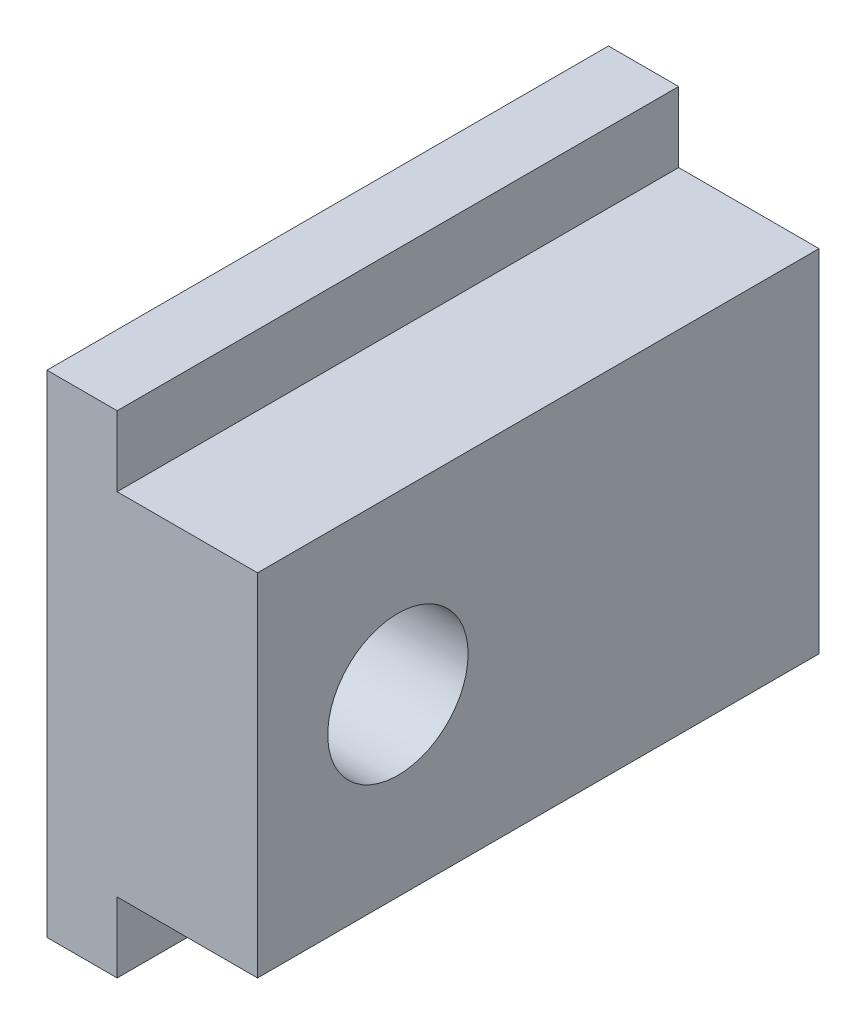
from build123d import *

# Parameters (mm, degrees)
BOSS_EXTRUDE1_DEPTH             = 25.4
SKETCH3_R                       = 3.175
CUT_EXTRUDE1_DEPTH              = 36.06902123
F_1_4_0_25_DIAMETER_HOLE1_D     = 6.35
F_1_4_0_25_DIAMETER_HOLE1_DEPTH = 12.7
F_1_4_0_25_DIAMETER_HOLE1_TIP   = 1.907732465


with BuildPart() as part:
    # Sketch1 → Boss-Extrude1 (new body)
    with BuildSketch(Plane.XY):
        Polygon((0, 0), (3.175, 0), (3.175, 3.175), (9.525, 3.175), (9.525, 19.05), (3.175, 19.05), (3.175, 22.225), (0, 22.225), align=None)
    extrude(amount=BOSS_EXTRUDE1_DEPTH)

    # Sketch3 → Cut-Extrude1 (cut, through all)
    with BuildSketch(Plane(origin=(9.525, 0, 0), x_dir=(0, 0, -1), z_dir=(1, 0, 0))):
        with Locations((-19.05, 11.1125)):
            Circle(SKETCH3_R)
    extrude(amount=-CUT_EXTRUDE1_DEPTH, mode=Mode.SUBTRACT)

    # 1/4 (0.25) Diameter Hole1
    with Locations(Plane(origin=(0, 0, 0), x_dir=(-1, 0, 0), z_dir=(0, 0, -1))):
        with Locations((-4.7625, 11.1125)):
            Hole(F_1_4_0_25_DIAMETER_HOLE1_D / 2, depth=F_1_4_0_25_DIAMETER_HOLE1_DEPTH)
            with Locations((0, 0, -(F_1_4_0_25_DIAMETER_HOLE1_DEPTH + F_1_4_0_25_DIAMETER_HOLE1_TIP / 2))):  # 118° drill point
                Cone(0, F_1_4_0_25_DIAMETER_HOLE1_D / 2, F_1_4_0_25_DIAMETER_HOLE1_TIP, mode=Mode.SUBTRACT)


solid = part.part
